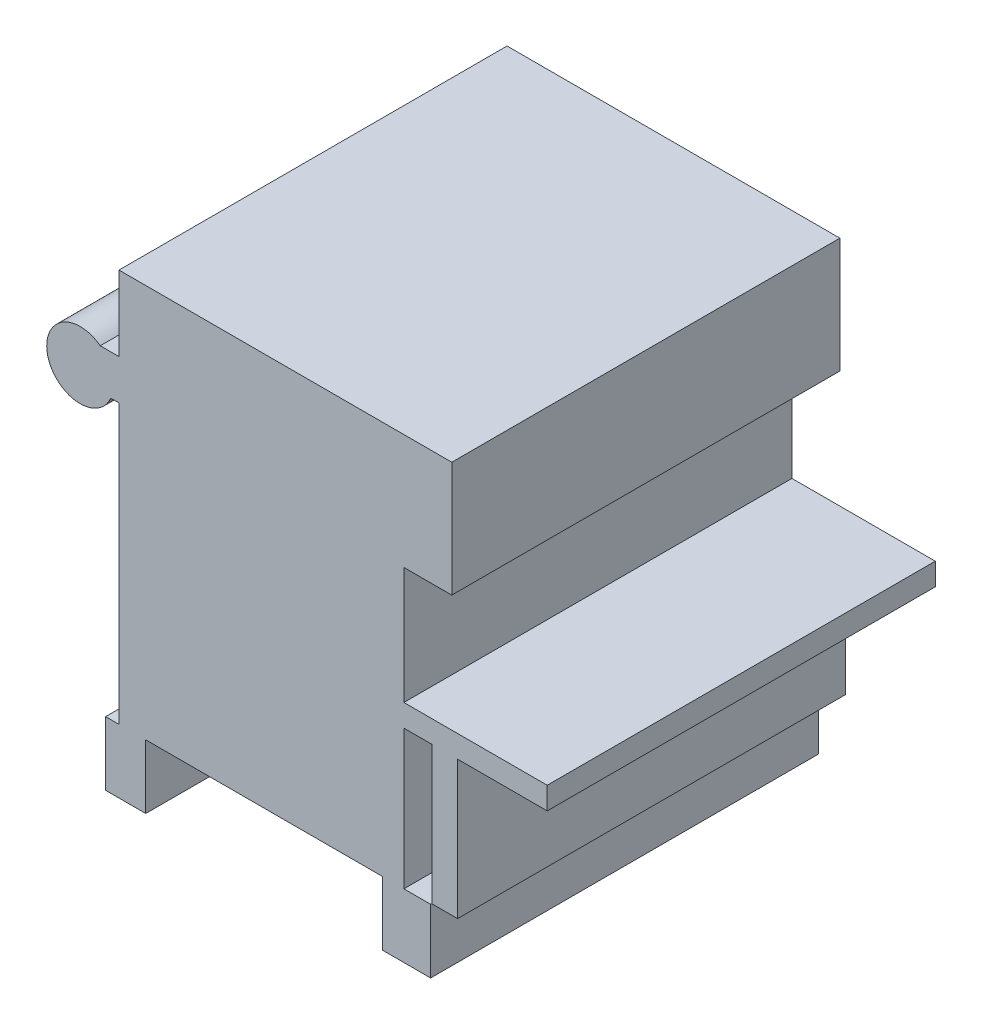
from build123d import *

# Parameters (mm, degrees)
BOSS_EXTRUDE1_DEPTH = 736.6


with BuildPart() as part:
    # Sketch1 → Boss-Extrude1 (new body)
    with BuildSketch(Plane.XY):
        with BuildLine():
            Line((540.766, 306.324), (540.766, 528.32))
            Line((540.766, 528.32), (631.698, 528.32))
            Line((631.698, 528.32), (631.698, 550.164))
            Line((631.698, 550.164), (631.698, 746.76))
            Line((631.698, 746.76), (0, 746.76))
            Line((0, 746.76), (0, 604.52))
            Line((0, 604.52), (-35.56, 604.52))
            ThreePointArc((-35.56, 604.52), (-135.060085104, 537.524952941), (-15.461288674, 528.32))
            Line((-15.461288674, 528.32), (0, 528.32))
            Line((0, 528.32), (0, 0))
            Line((0, 0), (-25.4, 0))
            Line((-25.4, 0), (-25.4, -121.158))
            Line((-25.4, -121.158), (50.8, -121.158))
            Line((50.8, -121.158), (50.8, 0))
            Line((50.8, 0), (500.126, 0))
            Line((500.126, 0), (500.126, -121.158))
            Line((500.126, -121.158), (591.566, -121.158))
            Line((591.566, -121.158), (591.566, 0))
            Line((591.566, 0), (540.766, 0))
            Line((540.766, 0), (540.766, 264.16))
            Line((540.766, 264.16), (594.106, 264.16))
            Line((594.106, 264.16), (594.106, 2.032))
            Line((594.106, 2.032), (642.704381111, 2.032))
            Line((642.704381111, 2.032), (642.704381111, 264.16))
            Line((642.704381111, 264.16), (812.8, 264.16))
            Line((812.8, 264.16), (812.8, 306.324))
            Line((812.8, 306.324), (540.766, 306.324))
        make_face()
    extrude(amount=BOSS_EXTRUDE1_DEPTH)


solid = part.part
